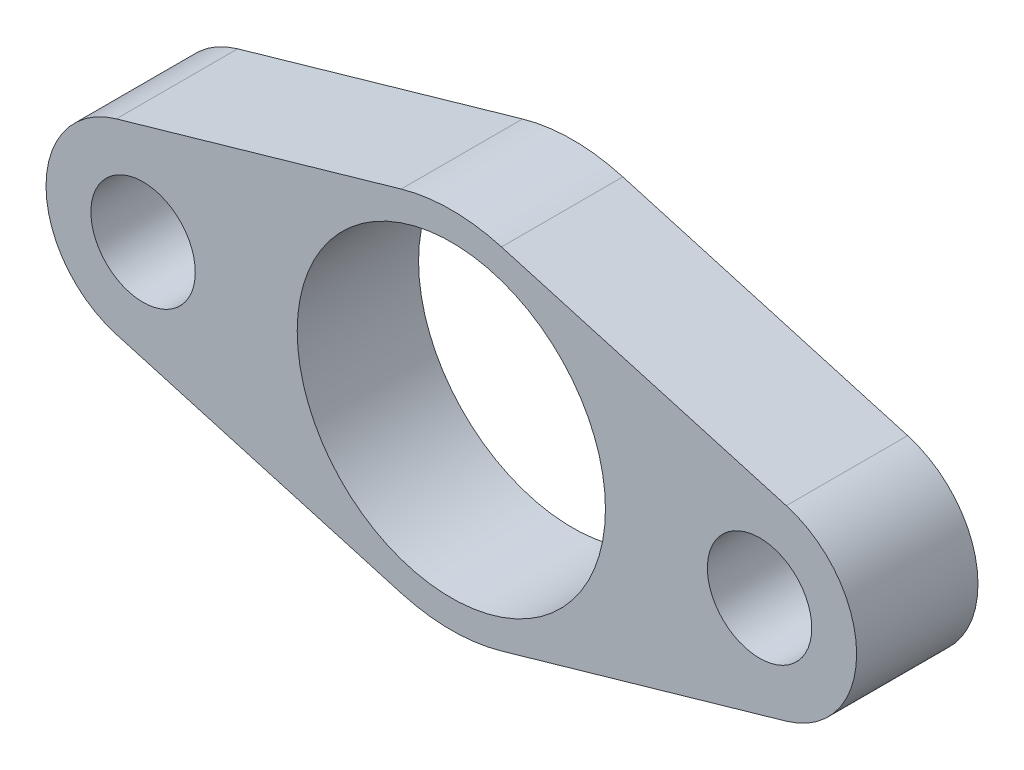
from build123d import *

# Parameters (mm, degrees)
SKETCH1_R           = 6.35
SKETCH1_R_2         = 2.15
BOSS_EXTRUDE1_DEPTH = 5


with BuildPart() as part:
    # Sketch1 → Boss-Extrude1 (new body)
    with BuildSketch(Plane.XY):
        with BuildLine():
            Line((2.066929134, 7.209563368), (13.802362205, 3.845100463))
            ThreePointArc((13.802362205, 3.845100463), (16.7, 0), (13.802362205, -3.845100463))
            Line((13.802362205, -3.845100463), (2.066929134, -7.209563368))
            ThreePointArc((2.066929134, -7.209563368), (0, -7.5), (-2.066929134, -7.209563368))
            Line((-2.066929134, -7.209563368), (-13.802362205, -3.845100463))
            ThreePointArc((-13.802362205, -3.845100463), (-16.7, 0), (-13.802362205, 3.845100463))
            Line((-13.802362205, 3.845100463), (-2.066929134, 7.209563368))
            ThreePointArc((-2.066929134, 7.209563368), (0, 7.5), (2.066929134, 7.209563368))
        make_face()
        Circle(SKETCH1_R, mode=Mode.SUBTRACT)
        with Locations((12.7, 0)):
            Circle(SKETCH1_R_2, mode=Mode.SUBTRACT)
        with Locations((-12.7, 0)):
            Circle(SKETCH1_R_2, mode=Mode.SUBTRACT)
    extrude(amount=BOSS_EXTRUDE1_DEPTH)


solid = part.part
